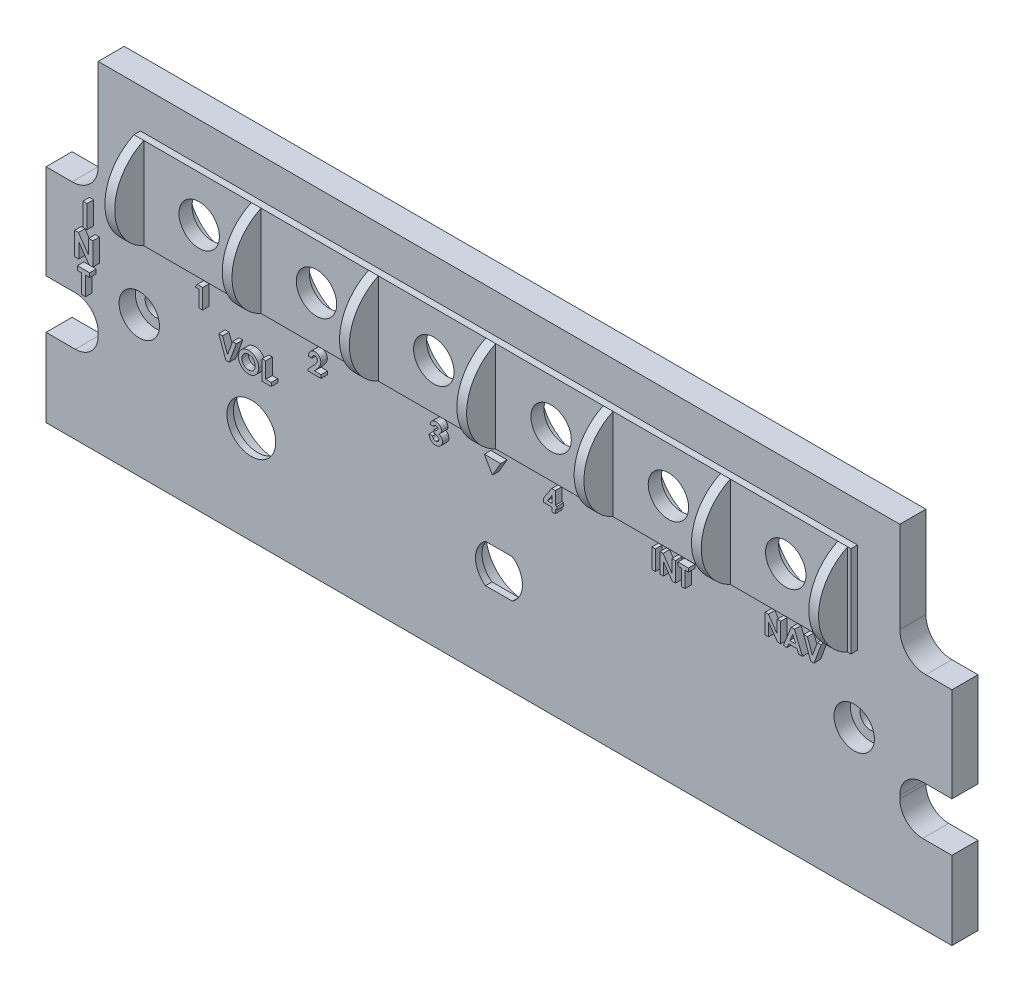
from build123d import *

# Parameters (mm, degrees)
SKETCH1_R               = 1.6
SKETCH1_R_2             = 3.1
SKETCH1_R_3             = 3.75
EXTRUSION_BASE_DEPTH    = 4
SKETCH6_R               = 6.7
SKETCH6_R_2             = 6
SKETCH6_R_3             = 6.35
BACK_HOLES_DEPTH        = 3
SKETCH7_W               = 110
SKETCH7_H               = 14
SKETCH7_R               = 3.1
BASE_SUICHES_DEPTH      = 1
SKETCH10_R              = 3.1
CAMA_TORNILLOS_DEPTH    = 2.5
SEPARADOR_SUICHES_DEPTH = 1.5
LPATTERN1_COUNT         = 7
LPATTERN1_PITCH         = 18
SKETCH4_W               = 0.628205128
SKETCH4_H               = 3.5
SKETCH4_W_2             = 0.538461539
SKETCH4_H_2             = 3
TEXTOS_DEPTH            = 1


with BuildPart() as part:
    # Sketch1 → Extrusion base (new body)
    with BuildSketch(Plane.XY):
        with BuildLine():
            Line((0, 0), (139, 0))
            Line((139, 0), (139, 12))
            Line((139, 12), (134.5, 12))
            ThreePointArc((134.5, 12), (132.025126266, 13.025126266), (131, 15.5))
            Line((131, 15.5), (131, 16))
            ThreePointArc((131, 16), (132.025126266, 18.474873734), (134.5, 19.5))
            Line((134.5, 19.5), (139, 19.5))
            Line((139, 19.5), (139, 34))
            Line((139, 34), (135, 34))
            ThreePointArc((135, 34), (132.171572875, 35.171572875), (131, 38))
            Line((131, 38), (131, 52))
            Line((131, 52), (8, 52))
            Line((8, 52), (8, 38))
            ThreePointArc((8, 38), (6.828427125, 35.171572875), (4, 34))
            Line((4, 34), (0, 34))
            Line((0, 34), (0, 19.5))
            Line((0, 19.5), (4.5, 19.5))
            ThreePointArc((4.5, 19.5), (6.974873734, 18.474873734), (8, 16))
            Line((8, 16), (8, 15.5))
            ThreePointArc((8, 15.5), (6.974873734, 13.025126266), (4.5, 12))
            Line((4.5, 12), (0, 12))
            Line((0, 12), (0, 0))
        make_face()
        with Locations((14.309088021, 21.5)):
            Circle(SKETCH1_R, mode=Mode.SUBTRACT)
        with Locations((124, 21.5)):
            Circle(SKETCH1_R, mode=Mode.SUBTRACT)
        with Locations((114.5, 39)):
            Circle(SKETCH1_R_2, mode=Mode.SUBTRACT)
        with Locations((31.5, 15)):
            Circle(SKETCH1_R_3, mode=Mode.SUBTRACT)
        with Locations((96.5, 39)):
            Circle(SKETCH1_R_2, mode=Mode.SUBTRACT)
        with Locations((78.5, 39)):
            Circle(SKETCH1_R_2, mode=Mode.SUBTRACT)
        with Locations((60.5, 39)):
            Circle(SKETCH1_R_2, mode=Mode.SUBTRACT)
        with Locations((42.5, 39)):
            Circle(SKETCH1_R_2, mode=Mode.SUBTRACT)
        with Locations((24.5, 39)):
            Circle(SKETCH1_R_2, mode=Mode.SUBTRACT)
        with BuildLine():
            Line((67.436628972, 12.05), (71.563371028, 12.05))
            ThreePointArc((71.563371028, 12.05), (73.1, 15), (71.563371028, 17.95))
            Line((71.563371028, 17.95), (67.436628972, 17.95))
            ThreePointArc((67.436628972, 17.95), (65.9, 15), (67.436628972, 12.05))
        make_face(mode=Mode.SUBTRACT)
    extrude(amount=EXTRUSION_BASE_DEPTH)

    # Sketch6 → Back holes (cut)
    with BuildSketch(Plane(origin=(0, 0, 0), x_dir=(-1, 0, 0), z_dir=(0, 0, -1))):
        with Locations((-24.5, 39)):
            Circle(SKETCH6_R)
        with Locations((-69.5, 15)):
            Circle(SKETCH6_R_2)
        with Locations((-42.5, 39)):
            Circle(SKETCH6_R)
        with Locations((-60.5, 39)):
            Circle(SKETCH6_R)
        with Locations((-78.5, 39)):
            Circle(SKETCH6_R)
        with Locations((-96.5, 39)):
            Circle(SKETCH6_R)
        with Locations((-114.5, 39)):
            Circle(SKETCH6_R)
        with Locations((-31.5, 15)):
            Circle(SKETCH6_R_3)
    extrude(amount=-BACK_HOLES_DEPTH, mode=Mode.SUBTRACT)

    # Sketch7 → Base suiches (add)
    with BuildSketch(Plane.XY.offset(4)):
        with Locations((69.5, 39)):
            Rectangle(SKETCH7_W, SKETCH7_H)
        with Locations(Location((114.5, 39, 0), (0, 0, 180))):
            Circle(SKETCH7_R, mode=Mode.SUBTRACT)
        with Locations(Location((96.5, 39, 0), (0, 0, 180))):
            Circle(SKETCH7_R, mode=Mode.SUBTRACT)
        with Locations(Location((78.5, 39, 0), (0, 0, 180))):
            Circle(SKETCH7_R, mode=Mode.SUBTRACT)
        with Locations(Location((60.5, 39, 0), (0, 0, 180))):
            Circle(SKETCH7_R, mode=Mode.SUBTRACT)
        with Locations(Location((42.5, 39, 0), (0, 0, 180))):
            Circle(SKETCH7_R, mode=Mode.SUBTRACT)
        with Locations(Location((24.5, 39, 0), (0, 0, 180))):
            Circle(SKETCH7_R, mode=Mode.SUBTRACT)
    extrude(amount=BASE_SUICHES_DEPTH)

    # Sketch10 → Cama tornillos (cut)
    with BuildSketch(Plane.XY.offset(4)):
        with Locations((124, 21.5)):
            Circle(SKETCH10_R)
        with Locations((14.309088021, 21.5)):
            Circle(SKETCH10_R)
    extrude(amount=-CAMA_TORNILLOS_DEPTH, mode=Mode.SUBTRACT)

    # Sketch9 → Separador Suiches (add)
    with BuildSketch(Plane.ZY.offset(-14.5)):
        with BuildLine():
            ThreePointArc((5, 46), (9.464271458, 39), (5, 32))
            Line((5, 32), (5, 46))
        make_face()
    separador_suiches = extrude(amount=-SEPARADOR_SUICHES_DEPTH)

    # LPattern1: Separador Suiches ×7
    with Locations(*[(i * LPATTERN1_PITCH, 0, 0) for i in range(1, LPATTERN1_COUNT)]):
        add(separador_suiches)

    # Sketch4 → Textos (add)
    # profile 1 of 17: a face of its own
    with BuildSketch(Plane.XY.offset(4)):
        Polygon((69.5, 28.267949192), (70.75, 30.433012702), (68.25, 30.433012702), align=None)
    # profile 2 of 17: a face of its own
    with BuildSketch(Plane.XY.offset(4)):
        with Locations((6.974358974, 31.510601488)):
            Rectangle(SKETCH4_W, SKETCH4_H)
    # profile 3 of 17: a face of its own
    with BuildSketch(Plane.XY.offset(4)):
        Polygon((24.200651525, 30.966514271), (25.032983256, 30.966514271), (25.032983256, 27.966514271), (24.494521717, 27.966514271), (24.494521717, 30.466514271), (23.879137102, 30.466514271), align=None)
    # profile 4 of 17: a face of its own
    with BuildSketch(Plane.XY.offset(4)):
        with BuildLine():
            Line((41.818388242, 29.966514271), (41.279926703, 29.966514271))
            add(Edge.make_bspline(
                [(41.279926703, 29.966514271), (41.282252236, 30.007246038), (41.286796188, 30.086833465), (41.304870878, 30.20243675), (41.329090343, 30.311669143), (41.361414434, 30.414148536), (41.40203177, 30.509837691), (41.449897161, 30.599062818), (41.50623346, 30.681354146), (41.569841645, 30.756314817), (41.639641824, 30.823562728), (41.714184876, 30.88318895), (41.794611039, 30.932391007), (41.87945086, 30.972879746), (41.968689893, 31.005228366), (42.06317248, 31.026856037), (42.162080538, 31.041502507), (42.229791113, 31.042784132), (42.264301703, 31.043437348)],
                knots=[0, 0, 0, 0, 1.199038563, 2.342849363, 3.436047546, 4.486744587, 5.497670872, 6.488682221, 7.459191391, 8.424610317, 9.374430501, 10.305433194, 11.225809216, 12.140057399, 13.06607119, 14.010487599, 14.985989317, 16, 16, 16, 16], degree=3))
            add(Edge.make_bspline(
                [(42.264301703, 31.043437348), (42.306662963, 31.042115565), (42.389362069, 31.039535135), (42.509530429, 31.01752321), (42.621754539, 30.980704863), (42.725952823, 30.929259923), (42.82123822, 30.86390452), (42.907594932, 30.785978897), (42.982411392, 30.693848135), (43.046161961, 30.591345644), (43.099131064, 30.482809932), (43.136249605, 30.370579505), (43.160647222, 30.257632503), (43.163249379, 30.181579709), (43.164542088, 30.143797925)],
                knots=[0, 0, 0, 0, 1.075374347, 2.099382735, 3.09057751, 4.06680945, 5.040638231, 6.016817125, 7.011024321, 8.044445721, 9.0776792, 10.070479129, 11.0414456, 12, 12, 12, 12], degree=3))
            add(Edge.make_bspline(
                [(43.164542088, 30.143797925), (43.164038775, 30.120944832), (43.163025731, 30.074947201), (43.155981902, 30.005341495), (43.145414766, 29.934439946), (43.129482101, 29.862303344), (43.109612761, 29.78891147), (43.08550838, 29.714044686), (43.056609832, 29.63812746), (43.023399377, 29.560305355), (42.983779219, 29.480325715), (42.937647053, 29.396989613), (42.883778426, 29.310370976), (42.822824003, 29.219980725), (42.754487743, 29.12596142), (42.678436051, 29.028596277), (42.595544864, 28.927542213), (42.536714657, 28.859993241), (42.506489203, 28.82528831)],
                knots=[0, 0, 0, 0, 0.728284026, 1.46585585, 2.227944881, 3.01186502, 3.81876927, 4.650621989, 5.517437689, 6.406905708, 7.346299482, 8.360816762, 9.441613733, 10.596154504, 11.834900912, 13.145207542, 14.533280747, 16, 16, 16, 16], degree=3))
            Line((42.506489203, 28.82528831), (42.193388242, 28.466514271))
            Line((42.193388242, 28.466514271), (43.203003626, 28.466514271))
            Line((43.203003626, 28.466514271), (43.203003626, 27.966514271))
            Line((43.203003626, 27.966514271), (41.203003626, 27.966514271))
            Line((41.203003626, 27.966514271), (41.203003626, 28.23935081))
            Line((41.203003626, 28.23935081), (42.09122478, 29.18466331))
            add(Edge.make_bspline(
                [(42.09122478, 29.18466331), (42.116941065, 29.212238369), (42.166745883, 29.265643081), (42.237613006, 29.344073582), (42.301741492, 29.418502256), (42.357801585, 29.489721617), (42.408735246, 29.5554216), (42.452271348, 29.617582483), (42.488808212, 29.67564231), (42.52847416, 29.745652322), (42.566143771, 29.829151719), (42.60070792, 29.925346448), (42.62177716, 30.017286454), (42.624685381, 30.077196539), (42.626080549, 30.105937348)],
                knots=[0, 0, 0, 0, 1.246127091, 2.413378631, 3.493388633, 4.492180848, 5.408488754, 6.240484944, 6.999099869, 7.674939598, 8.898438119, 10.020720584, 11.050475521, 12, 12, 12, 12], degree=3))
            add(Edge.make_bspline(
                [(42.626080549, 30.105937348), (42.625037416, 30.133741864), (42.623016178, 30.187617571), (42.600804406, 30.264255476), (42.56639316, 30.333643277), (42.517902853, 30.393707586), (42.459165905, 30.443066412), (42.391289844, 30.47977812), (42.31482806, 30.500960607), (42.261226893, 30.503611898), (42.233652665, 30.50497581)],
                knots=[0, 0, 0, 0, 1.062038974, 2.057870785, 3.028805853, 4.01125022, 4.991535629, 5.949134679, 6.94496649, 8, 8, 8, 8], degree=3))
            add(Edge.make_bspline(
                [(42.233652665, 30.50497581), (42.219407467, 30.504471964), (42.191363509, 30.503480063), (42.150141081, 30.496877248), (42.11091498, 30.485240474), (42.073248597, 30.469648836), (42.037543916, 30.448982007), (42.003890998, 30.423506847), (41.971935266, 30.393870739), (41.941823281, 30.360166351), (41.914417444, 30.322552243), (41.890075679, 30.281371945), (41.869949093, 30.236651017), (41.852228914, 30.188979845), (41.838562264, 30.1378464), (41.828611248, 30.083556712), (41.821046155, 30.026199102), (41.81929033, 29.986771139), (41.818388242, 29.966514271)],
                knots=[0, 0, 0, 0, 0.903469896, 1.778625579, 2.63899355, 3.493148037, 4.358286772, 5.247621495, 6.164656832, 7.118446693, 8.109501108, 9.111810964, 10.146451449, 11.215617525, 12.33435995, 13.498009769, 14.714554818, 16, 16, 16, 16], degree=3))
        make_face()
    # profile 5 of 17: a face of its own
    with BuildSketch(Plane.XY.offset(4)):
        with BuildLine():
            Line((60.475001143, 30.235745041), (59.936539604, 30.235745041))
            add(Edge.make_bspline(
                [(59.936539604, 30.235745041), (59.940341347, 30.262660812), (59.947794413, 30.315427399), (59.965628603, 30.391820272), (59.986960218, 30.46428414), (60.01359165, 30.532589525), (60.044825987, 30.596858101), (60.080345611, 30.657310407), (60.120534502, 30.713686971), (60.151339713, 30.747648436), (60.166707873, 30.764591195)],
                knots=[0, 0, 0, 0, 1.111473889, 2.178970933, 3.205615836, 4.199322666, 5.174200091, 6.12565194, 7.064921805, 8, 8, 8, 8], degree=3))
            add(Edge.make_bspline(
                [(60.166707873, 30.764591195), (60.188874408, 30.786945936), (60.232562318, 30.831004783), (60.305569939, 30.887439299), (60.382095409, 30.936279534), (60.463673479, 30.975000426), (60.549034734, 31.006340502), (60.638857995, 31.027391702), (60.732776212, 31.041359359), (60.79686358, 31.042735222), (60.82956845, 31.043437348)],
                knots=[0, 0, 0, 0, 1.01925491, 2.00884431, 2.983262333, 3.955970413, 4.92937149, 5.924503185, 6.940838805, 8, 8, 8, 8], degree=3))
            add(Edge.make_bspline(
                [(60.82956845, 31.043437348), (60.858644762, 31.042750914), (60.915802933, 31.041401521), (60.999811062, 31.030569331), (61.079905782, 31.011570876), (61.156933719, 30.986730823), (61.229762042, 30.952931778), (61.299998143, 30.913698282), (61.365679623, 30.865576768), (61.426960164, 30.8112043), (61.483258028, 30.752395153), (61.532012225, 30.689533011), (61.573927084, 30.624297068), (61.608459383, 30.556145335), (61.635010028, 30.484962492), (61.653436963, 30.411159752), (61.66549784, 30.334899967), (61.666699419, 30.283067218), (61.667308835, 30.256778695)],
                knots=[0, 0, 0, 0, 1.091422571, 2.145516843, 3.172569842, 4.178562979, 5.178154469, 6.181868002, 7.194278174, 8.227918432, 9.254613415, 10.245994977, 11.209837596, 12.161663635, 13.10878368, 14.055455738, 15.013766427, 16, 16, 16, 16], degree=3))
            add(Edge.make_bspline(
                [(61.667308835, 30.256778695), (61.666058276, 30.224222547), (61.663596311, 30.160129503), (61.6433941, 30.066324571), (61.611772148, 29.976630316), (61.566091161, 29.892301695), (61.508978293, 29.813568204), (61.438902718, 29.743062139), (61.357860368, 29.679678062), (61.297020796, 29.64561545), (61.265866527, 29.628172925)],
                knots=[0, 0, 0, 0, 0.992805628, 1.954529043, 2.915727527, 3.886831945, 4.871318353, 5.87440735, 6.911542536, 8, 8, 8, 8], degree=3))
            add(Edge.make_bspline(
                [(61.265866527, 29.628172925), (61.28725034, 29.621152169), (61.329268572, 29.607356699), (61.388992437, 29.580186676), (61.445783008, 29.550494345), (61.498662373, 29.515999683), (61.548156479, 29.478097502), (61.593963605, 29.436463799), (61.636357439, 29.391189357), (61.674645917, 29.342025183), (61.708628438, 29.289757562), (61.739119144, 29.235593845), (61.764214695, 29.178712629), (61.785473751, 29.119763537), (61.801659185, 29.058216765), (61.813055178, 28.994310802), (61.819642341, 28.928191421), (61.820646996, 28.883395581), (61.821154989, 28.860745041)],
                knots=[0, 0, 0, 0, 1.059543567, 2.081955587, 3.086750234, 4.076226789, 5.052108497, 6.020845489, 6.989030705, 7.970690546, 8.952259656, 9.923888338, 10.895517021, 11.877585046, 12.873342345, 13.889638361, 14.932918083, 16, 16, 16, 16], degree=3))
            add(Edge.make_bspline(
                [(61.821154989, 28.860745041), (61.820125219, 28.827457943), (61.818094722, 28.761822565), (61.805185773, 28.665148371), (61.781151638, 28.572978116), (61.749533401, 28.484251242), (61.707358104, 28.400113181), (61.65772487, 28.318633079), (61.596715653, 28.242636644), (61.528914385, 28.170114727), (61.453617123, 28.104181047), (61.371982642, 28.047019513), (61.285806014, 27.997964747), (61.194542022, 27.95814069), (61.098222376, 27.927471612), (60.997061763, 27.905302588), (60.890635133, 27.891739213), (60.817990631, 27.89031735), (60.780890566, 27.889591195)],
                knots=[0, 0, 0, 0, 1.005138573, 1.981928558, 2.936866704, 3.876260664, 4.820238198, 5.773547, 6.751179199, 7.756627054, 8.768222608, 9.766606018, 10.760583154, 11.757261445, 12.767156078, 13.807575856, 14.880313354, 16, 16, 16, 16], degree=3))
            add(Edge.make_bspline(
                [(60.780890566, 27.889591195), (60.745794502, 27.890356803), (60.677168795, 27.891853848), (60.576789335, 27.904811535), (60.48138816, 27.925713335), (60.390721804, 27.955176156), (60.305141049, 27.993384399), (60.223869815, 28.038881844), (60.14852985, 28.094292677), (60.078281721, 28.157115549), (60.014683742, 28.227599243), (59.957842126, 28.304111042), (59.90901024, 28.386941887), (59.867987824, 28.47573789), (59.835095581, 28.570654827), (59.809150276, 28.671499679), (59.791027056, 28.778469466), (59.785507591, 28.852066955), (59.78269345, 28.889591195)],
                knots=[0, 0, 0, 0, 1.066544725, 2.085487077, 3.070979577, 4.031932826, 4.977951092, 5.916076795, 6.857635327, 7.814973522, 8.776389752, 9.738577119, 10.707772778, 11.69409279, 12.707140348, 13.757286496, 14.856535458, 16, 16, 16, 16], degree=3))
            Line((59.78269345, 28.889591195), (60.321154989, 28.889591195))
            add(Edge.make_bspline(
                [(60.321154989, 28.889591195), (60.324567163, 28.870723514), (60.331213268, 28.833973759), (60.344176088, 28.780768283), (60.361068451, 28.731656342), (60.380600226, 28.686201431), (60.401697482, 28.643806743), (60.427188014, 28.606038019), (60.455204008, 28.571869682), (60.495631291, 28.531249986), (60.553424876, 28.489514944), (60.631465364, 28.453245208), (60.718278016, 28.431986686), (60.778968717, 28.429393212), (60.810337681, 28.428052733)],
                knots=[0, 0, 0, 0, 0.928156231, 1.807827665, 2.648129825, 3.438902246, 4.202261636, 4.936546065, 5.639352463, 6.338805438, 7.70633318, 9.064371875, 10.482673459, 12, 12, 12, 12], degree=3))
            add(Edge.make_bspline(
                [(60.810337681, 28.428052733), (60.826983162, 28.428338175), (60.859587935, 28.428897293), (60.907479492, 28.435094364), (60.953102944, 28.445300945), (60.996543265, 28.45917131), (61.038077001, 28.47655868), (61.076910607, 28.498978652), (61.11383561, 28.525045071), (61.1484506, 28.554350646), (61.180435565, 28.586283232), (61.207048936, 28.621643146), (61.231371632, 28.657575138), (61.249360873, 28.696430007), (61.265123324, 28.736116944), (61.274770749, 28.778076462), (61.282055248, 28.821428363), (61.282478593, 28.851096501), (61.28269345, 28.866153695)],
                knots=[0, 0, 0, 0, 1.110435564, 2.175094844, 3.216326037, 4.226890168, 5.215276772, 6.21526065, 7.213097102, 8.228249917, 9.239874822, 10.221364777, 11.178138315, 12.128914389, 13.072518965, 14.022636769, 14.996447288, 16, 16, 16, 16], degree=3))
            add(Edge.make_bspline(
                [(61.28269345, 28.866153695), (61.282123046, 28.882621301), (61.280987501, 28.915404531), (61.271709983, 28.963244763), (61.25705882, 29.00926321), (61.236706566, 29.053256081), (61.209528398, 29.095061227), (61.177458464, 29.135517387), (61.137970182, 29.172518888), (61.094646248, 29.209093751), (61.044407505, 29.240976), (60.98970065, 29.270398632), (60.929087901, 29.293809963), (60.86404887, 29.314720619), (60.793353283, 29.329993436), (60.717440133, 29.341082991), (60.63643188, 29.349337445), (60.580591838, 29.350521683), (60.551924219, 29.351129656)],
                knots=[0, 0, 0, 0, 0.809814727, 1.612155564, 2.388397, 3.182215007, 3.988903953, 4.837162975, 5.715530372, 6.646997145, 7.623086902, 8.637258368, 9.698941581, 10.815059213, 11.996518529, 13.252603015, 14.589518788, 16, 16, 16, 16], degree=3))
            Line((60.551924219, 29.351129656), (60.551924219, 29.851129656))
            add(Edge.make_bspline(
                [(60.551924219, 29.851129656), (60.58761711, 29.854169377), (60.65439144, 29.859856092), (60.747077789, 29.873154674), (60.825107748, 29.890930419), (60.890356767, 29.912375892), (60.944535372, 29.939917467), (60.991865502, 29.97032215), (61.032628449, 30.005632746), (61.067078607, 30.044796297), (61.094637661, 30.086854278), (61.114142355, 30.131152984), (61.127022235, 30.176321758), (61.128242603, 30.207215838), (61.128847296, 30.222523887)],
                knots=[0, 0, 0, 0, 1.70044513, 3.18119609, 4.440695891, 5.496282586, 6.431922213, 7.318171381, 8.16090191, 8.983045123, 9.787564368, 10.536848927, 11.275007137, 12, 12, 12, 12], degree=3))
            add(Edge.make_bspline(
                [(61.128847296, 30.222523887), (61.127804027, 30.242055295), (61.125767786, 30.280176467), (61.109953237, 30.334735896), (61.082500972, 30.383371105), (61.045692305, 30.425979752), (61.000839664, 30.461569687), (60.948264506, 30.487407373), (60.889107715, 30.502588167), (60.847487725, 30.504161904), (60.825962681, 30.50497581)],
                knots=[0, 0, 0, 0, 1.009664648, 1.970651636, 2.907870547, 3.878035693, 4.867062054, 5.849714035, 6.887914197, 8, 8, 8, 8], degree=3))
            add(Edge.make_bspline(
                [(60.825962681, 30.50497581), (60.806452649, 30.504015487), (60.767738769, 30.502109911), (60.71112749, 30.487887199), (60.657365635, 30.463945033), (60.607566462, 30.430930198), (60.562448831, 30.39128078), (60.525420273, 30.344324275), (60.494621674, 30.292873927), (60.481566959, 30.254862656), (60.475001143, 30.235745041)],
                knots=[0, 0, 0, 0, 0.98818071, 1.960853194, 2.938124878, 3.957524365, 4.978590984, 5.968022688, 6.978025184, 8, 8, 8, 8], degree=3))
        make_face()
    # profile 6 of 17: a face of its own
    with BuildSketch(Plane.XY.offset(4)):
        Polygon((27.503526855, 26.077309814), (28.078647047, 26.077309814), (28.849680701, 23.946300198), (29.621315317, 26.077309814), (30.195834547, 26.077309814), (29.108695124, 23.077309814), (28.589464355, 23.077309814), align=None)
    # profile 7 of 17: a face of its own
    with BuildSketch(Plane.XY.offset(4)):
        with BuildLine():
            add(Edge.make_bspline(
                [(32.086459547, 26.154232891), (32.138618224, 26.152882409), (32.241591266, 26.150216253), (32.393027451, 26.127991758), (32.538964215, 26.09178013), (32.679335567, 26.041443347), (32.813790033, 25.975618035), (32.942801879, 25.896170384), (33.06590899, 25.801600866), (33.181849863, 25.694115633), (33.289000141, 25.577230136), (33.381845919, 25.451382118), (33.461021392, 25.319832427), (33.526642236, 25.182228572), (33.576624723, 25.037617581), (33.611699501, 24.886736779), (33.634233309, 24.72962909), (33.636825043, 24.622660168), (33.63814224, 24.568295391)],
                knots=[0, 0, 0, 0, 1.014329547, 2.002516266, 2.970391464, 3.935626869, 4.897733899, 5.877609409, 6.878433252, 7.912639331, 8.949961323, 9.958554974, 10.949718813, 11.932905612, 12.9188844, 13.919928257, 14.942845884, 16, 16, 16, 16], degree=3))
            add(Edge.make_bspline(
                [(33.63814224, 24.568295391), (33.636739483, 24.514543179), (33.633975305, 24.408622722), (33.61261943, 24.252962842), (33.576953988, 24.103698287), (33.527819243, 23.960491195), (33.463388513, 23.82403521), (33.385757048, 23.693459081), (33.2928763, 23.569974585), (33.188133997, 23.453647988), (33.07282181, 23.348056641), (32.950687899, 23.255004448), (32.822296202, 23.176155532), (32.687834644, 23.111546008), (32.547014878, 23.061404936), (32.400184747, 23.026026767), (32.247353336, 23.004526739), (32.143420565, 23.001780616), (32.090666278, 23.000386737)],
                knots=[0, 0, 0, 0, 1.051557043, 2.072126891, 3.067553643, 4.050577992, 5.02905126, 6.015227836, 7.017913613, 8.04756643, 9.074058332, 10.072836633, 11.047628519, 12.017157415, 12.98668631, 13.966869689, 14.968021931, 16, 16, 16, 16], degree=3))
            add(Edge.make_bspline(
                [(32.090666278, 23.000386737), (32.035491619, 23.001637115), (31.927080957, 23.004093938), (31.768421466, 23.0274572), (31.616411965, 23.062650435), (31.472329421, 23.115174449), (31.334706475, 23.180833883), (31.204554285, 23.261697414), (31.081916589, 23.357631406), (30.967496859, 23.466178956), (30.863832306, 23.584953783), (30.772328004, 23.710428856), (30.695142096, 23.841645654), (30.632271757, 23.97866559), (30.582707307, 24.120637119), (30.547745219, 24.268424887), (30.527092279, 24.421674447), (30.524215445, 24.525764611), (30.522757624, 24.578511737)],
                knots=[0, 0, 0, 0, 1.067978421, 2.098431617, 3.099715153, 4.085208694, 5.062210972, 6.048429807, 7.046490867, 8.072918869, 9.098532598, 10.095778865, 11.076610158, 12.041847152, 13.011192615, 13.984257998, 14.978533688, 16, 16, 16, 16], degree=3))
            add(Edge.make_bspline(
                [(30.522757624, 24.578511737), (30.523215172, 24.613997242), (30.524124475, 24.684518923), (30.53507798, 24.789028455), (30.550847878, 24.891498102), (30.574170808, 24.991519315), (30.602502208, 25.089797697), (30.639209538, 25.185418449), (30.680992414, 25.279403064), (30.72981177, 25.370641465), (30.784094174, 25.458294183), (30.84332111, 25.541947745), (30.907641502, 25.620590657), (30.976848155, 25.694739727), (31.051179562, 25.763907569), (31.129657972, 25.82907335), (31.213805408, 25.888506035), (31.301780147, 25.943657088), (31.393086209, 25.993529229), (31.487351893, 26.035978904), (31.582635142, 26.073049482), (31.68020881, 26.102307221), (31.779027222, 26.126137344), (31.880146053, 26.141896613), (31.982651752, 26.152849814), (32.05177483, 26.153770771), (32.086459547, 26.154232891)],
                knots=[0, 0, 0, 0, 1.034744296, 2.056386356, 3.06226378, 4.057406941, 5.050368692, 6.043467995, 7.042652155, 8.049140477, 9.059438543, 10.048523776, 11.036952808, 12.020949711, 13.004946614, 13.997082645, 14.994316842, 16.007702937, 17.024872941, 18.026463647, 19.021641123, 20.005082605, 20.995858141, 21.984425357, 22.988620895, 24, 24, 24, 24], degree=3))
        make_face()
        with BuildLine():
            add(Edge.make_bspline(
                [(32.078046086, 25.615771352), (32.042943303, 25.614829466), (31.973664458, 25.612970559), (31.872045008, 25.598808202), (31.774486747, 25.576189308), (31.681530479, 25.543426117), (31.592773325, 25.501726889), (31.508057944, 25.451237328), (31.42855747, 25.390221911), (31.353211841, 25.321956284), (31.285149463, 25.245892687), (31.225014205, 25.164377607), (31.17469068, 25.077547172), (31.132544412, 24.986208017), (31.100817614, 24.889333058), (31.078219566, 24.787681126), (31.063938444, 24.681077069), (31.062138291, 24.608405223), (31.061219163, 24.571300198)],
                knots=[0, 0, 0, 0, 1.033739768, 2.040188636, 3.016340934, 3.979330865, 4.937572243, 5.900995986, 6.878200029, 7.884839167, 8.891893314, 9.879764717, 10.863503415, 11.843163062, 12.837761627, 13.859916423, 14.907309254, 16, 16, 16, 16], degree=3))
            add(Edge.make_bspline(
                [(31.061219163, 24.571300198), (31.062437786, 24.530179484), (31.064826086, 24.449589698), (31.081630455, 24.332027489), (31.110381058, 24.221001651), (31.15189637, 24.117055195), (31.203386248, 24.019033872), (31.267328504, 23.928139074), (31.342687578, 23.843826564), (31.400743597, 23.794601409), (31.430209547, 23.769617506)],
                knots=[0, 0, 0, 0, 1.078454662, 2.113592447, 3.107694534, 4.079536787, 5.043276885, 6.005368276, 6.987637804, 8, 8, 8, 8], degree=3))
            add(Edge.make_bspline(
                [(31.430209547, 23.769617506), (31.454347786, 23.751160358), (31.502080425, 23.714661904), (31.578272109, 23.667881649), (31.65673454, 23.627786303), (31.738059817, 23.595389738), (31.822076184, 23.569907145), (31.90877212, 23.552062103), (31.998024784, 23.540862797), (32.058381618, 23.539524267), (32.088863394, 23.538848275)],
                knots=[0, 0, 0, 0, 1.023928204, 2.024787132, 3.009472467, 3.9914905, 4.972207045, 5.96565515, 6.972602802, 8, 8, 8, 8], degree=3))
            add(Edge.make_bspline(
                [(32.088863394, 23.538848275), (32.123362583, 23.539798148), (32.191240823, 23.541667052), (32.290968572, 23.555655063), (32.386510785, 23.579327827), (32.478460595, 23.611803608), (32.566552861, 23.654026405), (32.650357051, 23.706081994), (32.730020097, 23.767331199), (32.805269737, 23.836493303), (32.874051465, 23.912856538), (32.934061234, 23.994806412), (32.985984795, 24.080537322), (33.02725463, 24.171262661), (33.060234883, 24.266126023), (33.082560951, 24.365547539), (33.096962717, 24.469117353), (33.098763377, 24.539600273), (33.099680701, 24.575506929)],
                knots=[0, 0, 0, 0, 1.026359118, 2.019393844, 2.989460624, 3.950973911, 4.916101784, 5.890408035, 6.881132271, 7.902007068, 8.92769091, 9.933912415, 10.920395702, 11.90457117, 12.894218921, 13.903490204, 14.931958862, 16, 16, 16, 16], degree=3))
            add(Edge.make_bspline(
                [(33.099680701, 24.575506929), (33.098731637, 24.611207112), (33.09686355, 24.681477479), (33.08285092, 24.784781016), (33.059328282, 24.883763615), (33.026754979, 24.978586923), (32.985160597, 25.069343903), (32.933724924, 25.1557154), (32.872628441, 25.237617913), (32.80327728, 25.314493308), (32.727792804, 25.385136872), (32.646752676, 25.446442644), (32.562424491, 25.499715411), (32.472873348, 25.541447145), (32.37993139, 25.574694729), (32.283031478, 25.599178727), (32.181806598, 25.612871067), (32.11294122, 25.614795973), (32.078046086, 25.615771352)],
                knots=[0, 0, 0, 0, 1.055025985, 2.07665775, 3.074803781, 4.057872707, 5.035505728, 6.020516407, 7.023567878, 8.050795229, 9.077271434, 10.074415901, 11.050397877, 12.019801805, 12.988065821, 13.964604439, 14.968634123, 16, 16, 16, 16], degree=3))
        make_face(mode=Mode.SUBTRACT)
    # profile 8 of 17: a face of its own
    with BuildSketch(Plane.XY.offset(4)):
        Polygon((34.176603778, 26.077309814), (34.715065317, 26.077309814), (34.715065317, 23.615771352), (35.561219163, 23.615771352), (35.561219163, 23.077309814), (34.176603778, 23.077309814), align=None)
    # profile 9 of 17: a face of its own
    with BuildSketch(Plane.XY.offset(4)):
        Polygon((111.341646172, 30.966514271), (111.826622133, 30.966514271), (113.187800018, 28.992355618), (113.187800018, 30.966514271), (113.726261556, 30.966514271), (113.726261556, 27.966514271), (113.237679825, 27.966514271), (111.88010771, 29.93466331), (111.88010771, 27.966514271), (111.341646172, 27.966514271), align=None)
    # profile 10 of 17: a face of its own
    with BuildSketch(Plane.XY.offset(4)):
        Polygon((115.34104521, 30.966514271), (115.841646172, 30.966514271), (117.053184633, 27.966514271), (116.478064441, 27.966514271), (116.244891364, 28.581898887), (114.939001941, 28.581898887), (114.705227902, 27.966514271), (114.13010771, 27.966514271), align=None)
        Polygon((115.591646172, 30.161826771), (115.143328864, 29.120360425), (116.040564441, 29.120360425), align=None, mode=Mode.SUBTRACT)
    # profile 11 of 17: a face of its own
    with BuildSketch(Plane.XY.offset(4)):
        Polygon((117.245492325, 30.966514271), (117.820612518, 30.966514271), (118.591646172, 28.835504656), (119.363280787, 30.966514271), (119.937800018, 30.966514271), (118.850660595, 27.966514271), (118.331429825, 27.966514271), align=None)
    # profile 12 of 17: a face of its own
    with BuildSketch(Plane.XY.offset(4)):
        with Locations((94.233138193, 29.466514271)):
            Rectangle(SKETCH4_W_2, SKETCH4_H_2)
    # profile 13 of 17: a face of its own
    with BuildSketch(Plane.XY.offset(4)):
        Polygon((95.194676654, 30.966514271), (95.679652616, 30.966514271), (97.0408305, 28.992355618), (97.0408305, 30.966514271), (97.579292039, 30.966514271), (97.579292039, 27.966514271), (97.090710308, 27.966514271), (95.733138193, 29.93466331), (95.733138193, 27.966514271), (95.194676654, 27.966514271), align=None)
    # profile 14 of 17: a face of its own
    with BuildSketch(Plane.XY.offset(4)):
        Polygon((97.963907423, 30.966514271), (99.579292039, 30.966514271), (99.579292039, 30.428052733), (99.0408305, 30.428052733), (99.0408305, 27.966514271), (98.502368962, 27.966514271), (98.502368962, 30.428052733), (97.963907423, 30.428052733), align=None)
    # profile 15 of 17: a face of its own
    with BuildSketch(Plane.XY.offset(4)):
        Polygon((5.403846154, 28.760601488), (5.969651442, 28.760601488), (7.557692308, 26.457416392), (7.557692308, 28.760601488), (8.185897436, 28.760601488), (8.185897436, 25.260601488), (7.615885417, 25.260601488), (6.032051282, 27.556775367), (6.032051282, 25.260601488), (5.403846154, 25.260601488), align=None)
    # profile 16 of 17: a face of its own
    with BuildSketch(Plane.XY.offset(4)):
        Polygon((5.820167772, 24.260601488), (7.704783157, 24.260601488), (7.704783157, 23.63239636), (7.076578029, 23.63239636), (7.076578029, 20.760601488), (6.448372901, 20.760601488), (6.448372901, 23.63239636), (5.820167772, 23.63239636), align=None)
    # profile 17 of 17: a face of its own
    with BuildSketch(Plane.XY.offset(4)):
        Polygon((78.584324398, 31.043437348), (79.145021513, 31.043437348), (79.145021513, 29.081898887), (79.414252282, 29.081898887), (79.414252282, 28.581898887), (79.145021513, 28.581898887), (79.145021513, 27.966514271), (78.606559975, 27.966514271), (78.606559975, 28.581898887), (77.337329205, 28.581898887), (77.337329205, 29.126971002), align=None)
        Polygon((78.606559975, 29.081898887), (78.606559975, 30.102932541), (77.942497475, 29.081898887), align=None, mode=Mode.SUBTRACT)
    extrude(amount=TEXTOS_DEPTH)


solid = part.part
